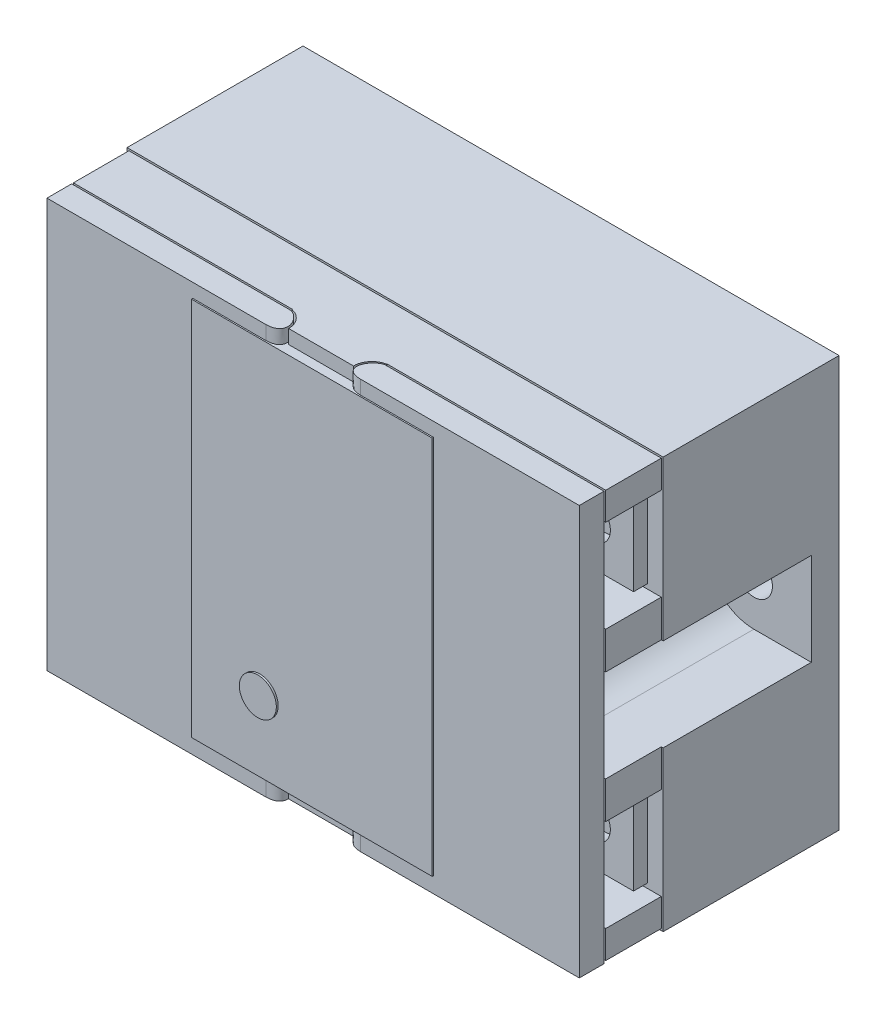
from build123d import *

# Parameters (mm, degrees)
SKETCH1_W               = 57.5
SKETCH1_H               = 44
BOSS_EXTRUDE1_DEPTH     = 28
SKETCH2_W               = 57.5
SKETCH2_H               = 44
SKETCH2_W_2             = 27
SKETCH2_H_2             = 41
CUT_EXTRUDE1_DEPTH      = 3
SKETCH3_W               = 10.2
SKETCH3_H               = 1.730752257
BOSS_EXTRUDE2_DEPTH     = 44
SKETCH4_W               = 0.5
SKETCH4_H               = 0.5
CUT_EXTRUDE2_DEPTH      = 59.453507166
SKETCH5_W               = 12
SKETCH5_H               = 10
CUT_EXTRUDE3_DEPTH      = 6
CUT_EXTRUDE4_DEPTH      = 22
SKETCH8_R               = 2
BOSS_EXTRUDE3_DEPTH     = 0.2
SKETCH9_W               = 55.5
SKETCH9_H               = 42
BOSS_EXTRUDE4_DEPTH     = 0.2
SKETCH7_R               = 2
CUT_EXTRUDE5_DEPTH      = 22
SKETCH10_W              = 57.9
SKETCH10_H              = 44.4
SKETCH10_W_2            = 57.5
SKETCH10_H_2            = 44
BOSS_EXTRUDE5_DEPTH     = 19
SKETCH11_W              = 2.584328925
SKETCH11_H              = 10
SKETCH11_W_2            = 1.649136063
CUT_EXTRUDE6_DEPTH      = 22
SKETCH12_W              = 9
SKETCH12_H              = 9
SKETCH12_R              = 2
BOSS_EXTRUDE6_DEPTH     = 1.5
MIRROR3_COPY_1_SKETCH_W = 9
MIRROR3_COPY_1_SKETCH_H = 9
MIRROR3_COPY_1_SKETCH_R = 2
MIRROR3_COPY_1_DEPTH    = 1.5
BOSS_EXTRUDE7_DEPTH     = 44.2
BOSS_EXTRUDE7_2_DEPTH   = 44.2


with BuildPart() as part:
    # Sketch1 → Boss-Extrude1 (new body)
    with BuildSketch(Plane.XY):
        Rectangle(SKETCH1_W, SKETCH1_H)
    extrude(amount=BOSS_EXTRUDE1_DEPTH)

    # Sketch2 → Cut-Extrude1 (cut)
    with BuildSketch(Plane.XY.offset(28)):
        Rectangle(SKETCH2_W, SKETCH2_H)
        Rectangle(SKETCH2_W_2, SKETCH2_H_2, mode=Mode.SUBTRACT)
    extrude(amount=-CUT_EXTRUDE1_DEPTH, mode=Mode.SUBTRACT)

    # Sketch3 → Boss-Extrude2 (add, through all)
    with BuildSketch(Plane(origin=(0, 22, 0), x_dir=(1, 0, 0), z_dir=(0, 1, 0))):
        with BuildLine():
            Line((-3.5, -26.999540764), (3.5, -26.999540764))
            ThreePointArc((3.5, -26.999540764), (3.950806662, -25.7346297), (5.1, -25.039948969))
            Line((5.1, -25.039948969), (5.1, -25))
            Line((5.1, -25), (-5.1, -25))
            Line((-5.1, -25), (-5.1, -25.039948969))
            ThreePointArc((-5.1, -25.039948969), (-3.950806662, -25.7346297), (-3.5, -26.999540764))
        make_face()
        with Locations((0, -24.134623872)):
            Rectangle(SKETCH3_W, SKETCH3_H)
    extrude(amount=-BOSS_EXTRUDE2_DEPTH)

    # Sketch4 → Cut-Extrude2 (cut, through all)
    with BuildSketch(Plane(origin=(0, 20.5, 0), x_dir=(1, 0, 0), z_dir=(0, 1, 0))):
        with Locations((13.25, -27.75)):
            Rectangle(SKETCH4_W, SKETCH4_H)
        with Locations((-13.25, -27.75)):
            Rectangle(SKETCH4_W, SKETCH4_H)
    extrude(amount=-CUT_EXTRUDE2_DEPTH, mode=Mode.SUBTRACT)

    # Sketch5 → Cut-Extrude3 (cut)
    with BuildSketch(Plane.XY.offset(25)):
        with Locations((22.75, -14)):
            Rectangle(SKETCH5_W, SKETCH5_H)
        with Locations((22.75, 14)):
            Rectangle(SKETCH5_W, SKETCH5_H)
    cut_extrude3 = extrude(amount=-CUT_EXTRUDE3_DEPTH, mode=Mode.SUBTRACT)

    # Sketch6 → Cut-Extrude4 (cut)
    with BuildSketch(Plane.XY.offset(25)):
        with BuildLine():
            Line((22.75, -5), (28.75, -5))
            Line((28.75, -5), (28.75, 5))
            Line((28.75, 5), (22.75, 5))
            ThreePointArc((22.75, 5), (26.285533906, 3.535533906), (27.75, 0))
            ThreePointArc((27.75, 0), (26.285533906, -3.535533906), (22.75, -5))
        make_face()
        with BuildLine():
            ThreePointArc((22.75, 5), (17.75, 0), (22.75, -5))
            Line((22.75, -5), (22.75, 5))
        make_face()
        with BuildLine():
            Line((22.75, 5), (22.75, -5))
            ThreePointArc((22.75, -5), (26.285533906, -3.535533906), (27.75, 0))
            ThreePointArc((27.75, 0), (26.285533906, 3.535533906), (22.75, 5))
        make_face()
        with BuildLine():
            ThreePointArc((22.75, 5), (17.75, 0), (22.75, -5))
            Line((22.75, -5), (22.75, 5))
        make_face()
        with BuildLine():
            Line((22.75, 5), (22.75, -5))
            ThreePointArc((22.75, -5), (26.285533906, -3.535533906), (27.75, 0))
            ThreePointArc((27.75, 0), (26.285533906, 3.535533906), (22.75, 5))
        make_face()
    cut_extrude4 = extrude(amount=-CUT_EXTRUDE4_DEPTH, mode=Mode.SUBTRACT)

    # Mirror1: Cut-Extrude3, Cut-Extrude4 across plane
    add(cut_extrude3.mirror(Plane(origin=(0, 0, 0), x_dir=(0, 0, 1), z_dir=(1, 0, 0))), mode=Mode.SUBTRACT)
    add(cut_extrude4.mirror(Plane(origin=(0, 0, 0), x_dir=(0, 0, 1), z_dir=(1, 0, 0))), mode=Mode.SUBTRACT)

    # Sketch8 → Boss-Extrude3 (add)
    with BuildSketch(Plane.XY.offset(28)):
        with Locations((-5.62819331, -12.868629494)):
            Circle(SKETCH8_R)
    extrude(amount=BOSS_EXTRUDE3_DEPTH)

    # Sketch9 → Boss-Extrude4 (add)
    with BuildSketch(Plane(origin=(0, 0, 0), x_dir=(-1, 0, 0), z_dir=(0, 0, -1))):
        Rectangle(SKETCH9_W, SKETCH9_H)
    extrude(amount=BOSS_EXTRUDE4_DEPTH)

    # Sketch7 → Cut-Extrude5 (cut)
    with BuildSketch(Plane.XY.offset(3)):
        with Locations((22.75, 0)):
            Circle(SKETCH7_R)
        with Locations((-22.75, 0)):
            Circle(SKETCH7_R)
    extrude(amount=-CUT_EXTRUDE5_DEPTH, mode=Mode.SUBTRACT)

    # Sketch10 → Boss-Extrude5 (add)
    with BuildSketch(Plane(origin=(0, 0, 0), x_dir=(-1, 0, 0), z_dir=(0, 0, -1))):
        Rectangle(SKETCH10_W, SKETCH10_H)
        Rectangle(SKETCH10_W_2, SKETCH10_H_2, mode=Mode.SUBTRACT)
    extrude(amount=-BOSS_EXTRUDE5_DEPTH)

    # Sketch11 → Cut-Extrude6 (cut)
    with BuildSketch(Plane.XY.offset(25)):
        with Locations((-30.042164463, 0)):
            Rectangle(SKETCH11_W, SKETCH11_H)
        with Locations((29.574568032, 0)):
            Rectangle(SKETCH11_W_2, SKETCH11_H)
    extrude(amount=-CUT_EXTRUDE6_DEPTH, mode=Mode.SUBTRACT)

    # Sketch12 → Boss-Extrude6 (add)
    with BuildSketch(Plane.XY.offset(19)):
        with Locations((-22.75, -14)):
            Rectangle(SKETCH12_W, SKETCH12_H)
        with Locations((-22.75, -14)):
            Circle(SKETCH12_R, mode=Mode.SUBTRACT)
    boss_extrude6 = extrude(amount=BOSS_EXTRUDE6_DEPTH)

    # Mirror2: Boss-Extrude6 across plane
    add(boss_extrude6.mirror(Plane.ZX))

    # Mirror3: Boss-Extrude6 across plane
    add(boss_extrude6.mirror(Plane(origin=(0, 0, 0), x_dir=(0, 0, 1), z_dir=(1, 0, 0))))

    # Mirror3 copy 1 sketch → Mirror3 copy 1 (add)
    with BuildSketch(Plane(origin=(0, 0, 19), x_dir=(-1, 0, 0), z_dir=(0, 0, 1))):
        with Locations((-22.75, -14)):
            Rectangle(MIRROR3_COPY_1_SKETCH_W, MIRROR3_COPY_1_SKETCH_H)
        with Locations((-22.75, -14)):
            Circle(MIRROR3_COPY_1_SKETCH_R, mode=Mode.SUBTRACT)
    extrude(amount=MIRROR3_COPY_1_DEPTH)


with BuildPart() as body_2:
    # Sketch14 → Boss-Extrude7 (new, through all)
    with BuildSketch(Plane(origin=(0, 22, 0), x_dir=(1, 0, 0), z_dir=(0, 1, 0))):
        with BuildLine():
            Line((-5.1, -25.186992194), (-28.75, -25.186992194))
            Line((-28.75, -25.186992194), (-28.75, -27.855473738))
            Line((-28.75, -27.855473738), (-5.1, -27.855473738))
            add(Edge.make_bspline(
                [(-5.1, -27.855473738), (-4.309245216, -27.837222897), (-3.79867042, -27.493257099), (-3.620504351, -26.29875873), (-4.399923319, -25.331121248), (-5.1, -25.186992194)],
                knots=[0, 0, 0, 0, 0.351045262, 0.451045262, 1, 1, 1, 1], degree=3))
        make_face()
    extrude(amount=-BOSS_EXTRUDE7_DEPTH)


with BuildPart() as body_3:
    # Sketch14 → Boss-Extrude7 2 (new, through all)
    with BuildSketch(Plane(origin=(0, 22, 0), x_dir=(1, 0, 0), z_dir=(0, 1, 0))):
        with BuildLine():
            Line((28.75, -27.855473738), (5.1, -27.855473738))
            add(Edge.make_bspline(
                [(5.1, -27.855473738), (4.309245216, -27.837222897), (3.79867042, -27.493257099), (3.620504351, -26.29875873), (4.399923319, -25.331121248), (5.1, -25.186992194)],
                knots=[0, 0, 0, 0, 0.351045262, 0.451045262, 1, 1, 1, 1], degree=3))
            Line((5.1, -25.186992194), (28.75, -25.186992194))
            Line((28.75, -25.186992194), (28.75, -27.855473738))
        make_face()
    extrude(amount=-BOSS_EXTRUDE7_2_DEPTH)


solid = Compound([part.part, body_2.part, body_3.part])
